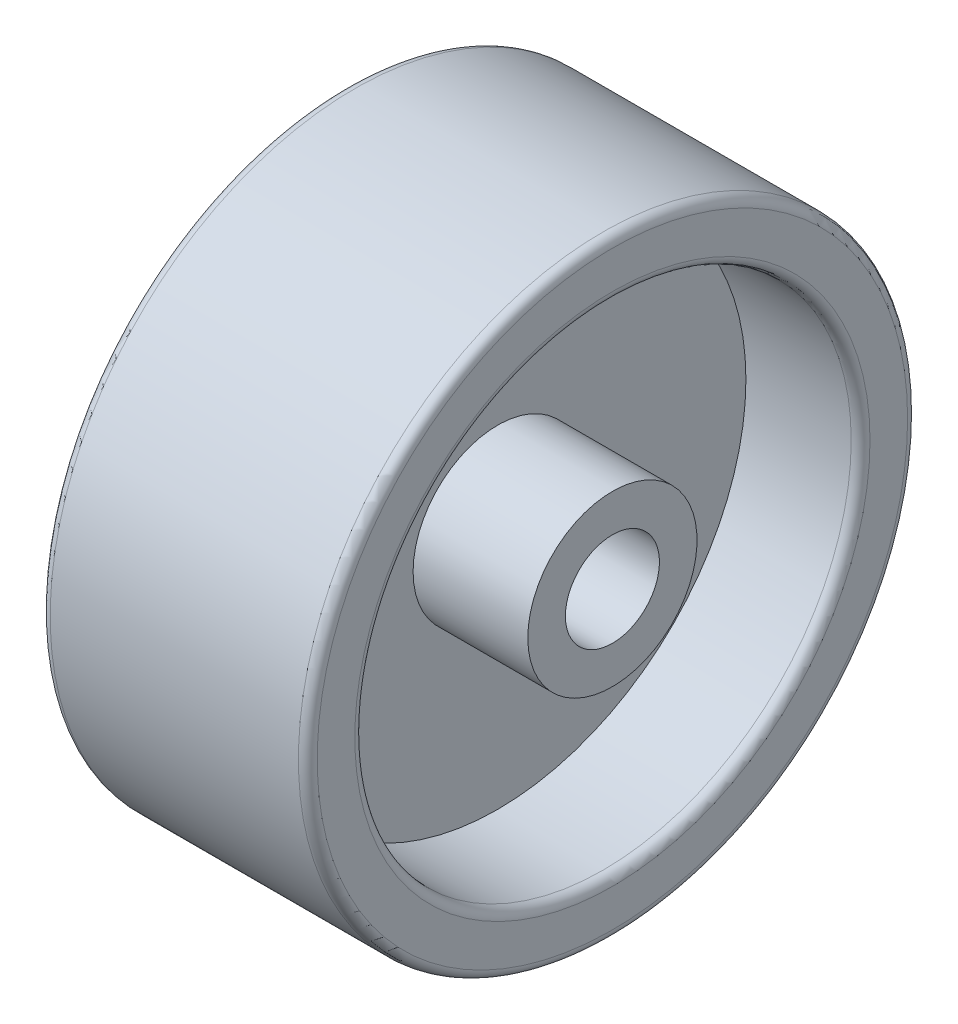
from build123d import *

# Parameters (mm, degrees)
SKETCH1_R           = 16.2
BOSS_EXTRUDE1_DEPTH = 7.1
SKETCH6_R           = 13.2
SKETCH6_R_2         = 4.5
CUT_EXTRUDE2_DEPTH  = 6.1
FILLET2_R           = 0.5
FILLET3_R           = 0.5
FILLET4_R           = 0.5
FILLET5_R           = 0.5
SKETCH7_R           = 2.5
CUT_EXTRUDE3_DEPTH  = 27.954035009


with BuildPart() as part:
    # Sketch1 → Boss-Extrude1 (new, symmetric)
    with BuildSketch(Plane(origin=(0, 0, 0), x_dir=(0, 0, -1), z_dir=(1, 0, 0))):
        Circle(SKETCH1_R)
    extrude(amount=BOSS_EXTRUDE1_DEPTH, both=True)

    # Sketch6 → Cut-Extrude2 (cut)
    with BuildSketch(Plane.ZY.offset(7.1)):
        Circle(SKETCH6_R)
        Circle(SKETCH6_R_2, mode=Mode.SUBTRACT)
    cut_extrude2 = extrude(amount=-CUT_EXTRUDE2_DEPTH, mode=Mode.SUBTRACT)

    # Mirror1: Cut-Extrude2 across plane
    add(cut_extrude2.mirror(Plane(origin=(0, 0, 0), x_dir=(0, 0, 1), z_dir=(1, 0, 0))), mode=Mode.SUBTRACT)

    # Fillet2
    fillet2_edges = [part.edges().sort_by_distance(p)[0] for p in [
        (-7.1, 0, 16.2),
    ]]
    fillet(fillet2_edges, radius=FILLET2_R)

    # Fillet3
    fillet3_edges = [part.edges().sort_by_distance(p)[0] for p in [
        (-7.1, 0, -13.2),
    ]]
    fillet(fillet3_edges, radius=FILLET3_R)

    # Fillet4
    fillet4_edges = [part.edges().sort_by_distance(p)[0] for p in [
        (7.1, 0, -13.2),
    ]]
    fillet(fillet4_edges, radius=FILLET4_R)

    # Fillet5
    fillet5_edges = [part.edges().sort_by_distance(p)[0] for p in [
        (7.1, 0, 16.2),
    ]]
    fillet(fillet5_edges, radius=FILLET5_R)

    # Sketch7 → Cut-Extrude3 (cut, through all)
    with BuildSketch(Plane.ZY.offset(7.1)):
        Circle(SKETCH7_R)
    extrude(amount=-CUT_EXTRUDE3_DEPTH, mode=Mode.SUBTRACT)


solid = part.part
